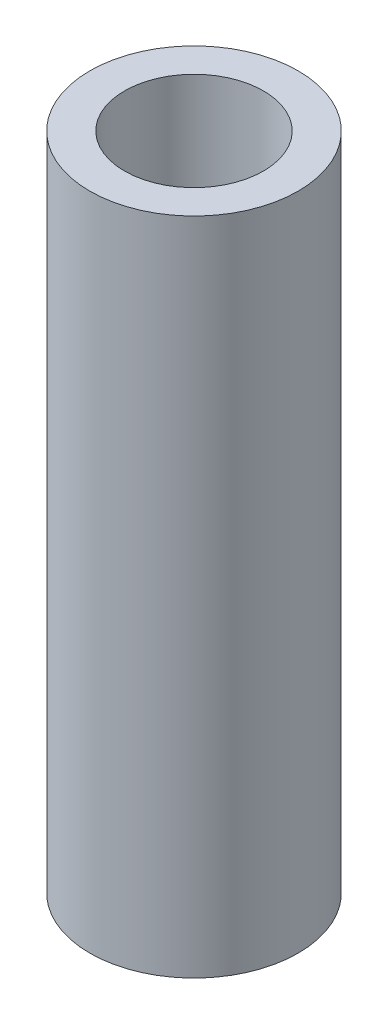
from build123d import *

# Parameters (mm, degrees)
SKETCH2_R           = 30
SKETCH2_R_2         = 20
BOSS_EXTRUDE1_DEPTH = 190


with BuildPart() as part:
    # Sketch2 → Boss-Extrude1 (new body)
    with BuildSketch(Plane(origin=(0, 0, 0), x_dir=(1, 0, 0), z_dir=(0, 1, 0))):
        with Locations(Location((0, 0, 0), (0, 0, 270))):
            Circle(SKETCH2_R)
        with Locations(Location((0, 0, 0), (0, 0, 270))):
            Circle(SKETCH2_R_2, mode=Mode.SUBTRACT)
    extrude(amount=BOSS_EXTRUDE1_DEPTH)


solid = part.part
